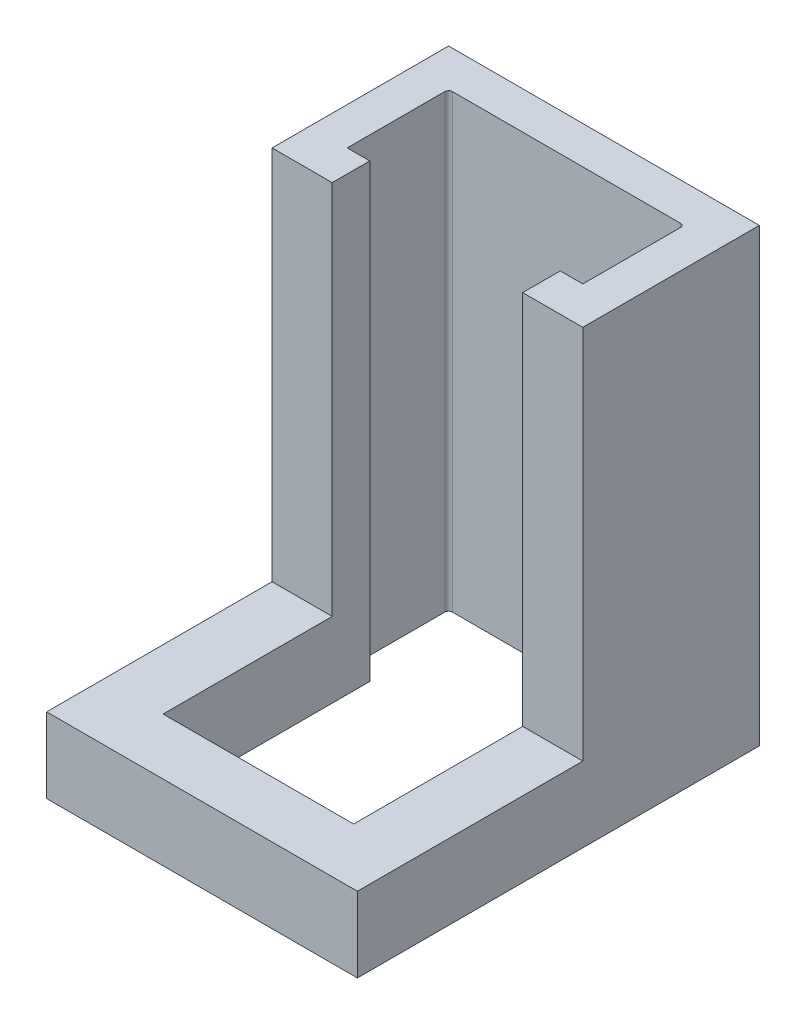
from build123d import *

# Parameters (mm, degrees)
BOSS_EXTRUDE1_DEPTH = 50
BOSS_EXTRUDE2_START = 10
BOSS_EXTRUDE2_DEPTH = 10
CUT_EXTRUDE1_REACH  = 78.086
SKETCH3_R           = 1.5


with BuildPart() as part:
    # Sketch1 → Boss-Extrude1 (new body)
    with BuildSketch(Plane(origin=(0, 0, 0), x_dir=(1, 0, 0), z_dir=(0, 1, 0))):
        with BuildLine():
            Line((15.6765625, 0), (15.6765625, 12.99375))
            ThreePointArc((15.6765625, 12.99375), (15.530115891, 13.347303391), (15.1765625, 13.49375))
            Line((15.1765625, 13.49375), (-15.1765625, 13.49375))
            ThreePointArc((-15.1765625, 13.49375), (-15.530115891, 13.347303391), (-15.6765625, 12.99375))
            Line((-15.6765625, 12.99375), (-15.6765625, 0))
            Line((-15.6765625, 0), (-12.6765625, 0))
            Line((-12.6765625, 0), (-12.6765625, -5))
            Line((-12.6765625, -5), (-20.6765625, -5))
            Line((-20.6765625, -5), (-20.6765625, 0))
            Line((-20.6765625, 0), (-20.6765625, 18.49375))
            Line((-20.6765625, 18.49375), (20.6765625, 18.49375))
            Line((20.6765625, 18.49375), (20.6765625, 0))
            Line((20.6765625, 0), (20.6765625, -5))
            Line((20.6765625, -5), (12.6765625, -5))
            Line((12.6765625, -5), (12.6765625, 0))
            Line((12.6765625, 0), (15.6765625, 0))
        make_face()
    extrude(amount=BOSS_EXTRUDE1_DEPTH)

    # Sketch2 → Boss-Extrude2 (add)
    with BuildSketch(Plane.XZ.offset(BOSS_EXTRUDE2_START)):
        Polygon((-20.6765625, -18.49375), (-20.6765625, 5), (-20.6765625, 35), (20.6765625, 35), (20.6765625, 5), (20.6765625, -18.49375), align=None)
        with BuildLine():
            Line((-12.6765625, 5), (-12.6765625, 0))
            Line((-12.6765625, 0), (-15.6765625, 0))
            Line((-15.6765625, 0), (-15.6765625, -12.99375))
            ThreePointArc((-15.6765625, -12.99375), (-15.530115891, -13.347303391), (-15.1765625, -13.49375))
            Line((-15.1765625, -13.49375), (15.1765625, -13.49375))
            ThreePointArc((15.1765625, -13.49375), (15.530115891, -13.347303391), (15.6765625, -12.99375))
            Line((15.6765625, -12.99375), (15.6765625, 0))
            Line((15.6765625, 0), (12.6765625, 0))
            Line((12.6765625, 0), (12.6765625, 5))
            Line((12.6765625, 5), (12.6765625, 27.5))
            Line((12.6765625, 27.5), (-12.6765625, 27.5))
            Line((-12.6765625, 27.5), (-12.6765625, 5))
        make_face(mode=Mode.SUBTRACT)
    extrude(amount=-BOSS_EXTRUDE2_DEPTH)

    # Sketch3 → Cut-Extrude1 (cut, up to next)
    with BuildSketch(Plane(origin=(0, 0, -18.49375), x_dir=(-1, 0, 0), z_dir=(0, 0, -1)), mode=Mode.PRIVATE) as cut_extrude1_sk1:
        with Locations((0, 10)):
            Circle(SKETCH3_R)
    cut_extrude1_tool1 = extrude(cut_extrude1_sk1.sketch, amount=-CUT_EXTRUDE1_REACH, mode=Mode.PRIVATE) & part.part
    # Sketch3 → Cut-Extrude1 (cut, up to next)
    with BuildSketch(Plane(origin=(0, 0, -18.49375), x_dir=(-1, 0, 0), z_dir=(0, 0, -1)), mode=Mode.PRIVATE) as cut_extrude1_sk2:
        with Locations((0, 20)):
            Circle(SKETCH3_R)
    cut_extrude1_tool2 = extrude(cut_extrude1_sk2.sketch, amount=-CUT_EXTRUDE1_REACH, mode=Mode.PRIVATE) & part.part
    # Sketch3 → Cut-Extrude1 (cut, up to next)
    with BuildSketch(Plane(origin=(0, 0, -18.49375), x_dir=(-1, 0, 0), z_dir=(0, 0, -1)), mode=Mode.PRIVATE) as cut_extrude1_sk3:
        with Locations((0, 30)):
            Circle(SKETCH3_R)
    cut_extrude1_tool3 = extrude(cut_extrude1_sk3.sketch, amount=-CUT_EXTRUDE1_REACH, mode=Mode.PRIVATE) & part.part
    add(cut_extrude1_tool1.solids().sort_by_distance((0, 10, -18.49375))[0], mode=Mode.SUBTRACT)
    add(cut_extrude1_tool2.solids().sort_by_distance((0, 20, -18.49375))[0], mode=Mode.SUBTRACT)
    add(cut_extrude1_tool3.solids().sort_by_distance((0, 30, -18.49375))[0], mode=Mode.SUBTRACT)


solid = part.part
